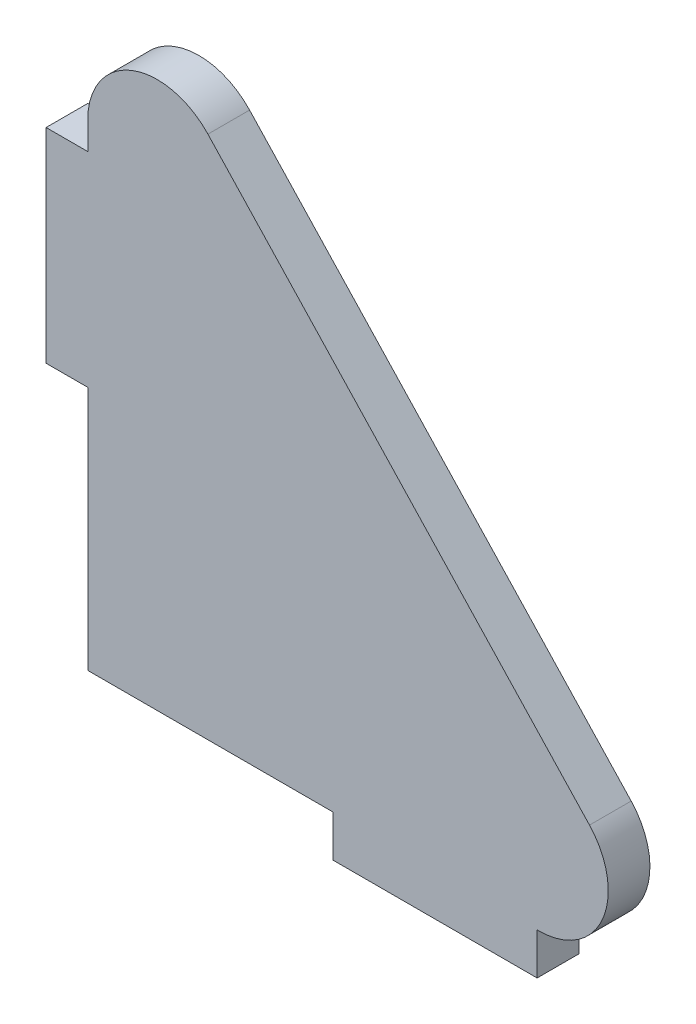
from build123d import *

# Parameters (mm, degrees)
SKETCH1_W           = 14.7
SKETCH1_H           = 3
SKETCH1_W_2         = 3
SKETCH1_H_2         = 14.7
BOSS_EXTRUDE1_DEPTH = 3
FILLET1_R           = 5


with BuildPart() as part:
    # Sketch1 → Boss-Extrude1 (new body)
    with BuildSketch(Plane.XY):
        Polygon((33.892723269, -30.02061011), (12.617997994, -7.295335385), (-10.107276731, -30.02061011), (7.542723269, -30.02061011), (22.242723269, -30.02061011), align=None)
        with Locations((14.892723269, -31.52061011)):
            Rectangle(SKETCH1_W, SKETCH1_H)
        Polygon((12.617997994, -7.295335385), (-10.107276731, 16.97938989), (-10.107276731, 2.32938989), (-10.107276731, -12.37061011), (-10.107276731, -30.02061011), align=None)
        with Locations((-11.607276731, -5.02061011)):
            Rectangle(SKETCH1_W_2, SKETCH1_H_2)
    extrude(amount=BOSS_EXTRUDE1_DEPTH)

    # Fillet1
    fillet1_edges = [part.edges().sort_by_distance(p)[0] for p in [
        (33.892723269, -30.02061011, 1.5),
        (-10.107276731, 16.97938989, 1.5),
    ]]
    fillet(fillet1_edges, radius=FILLET1_R)


solid = part.part
